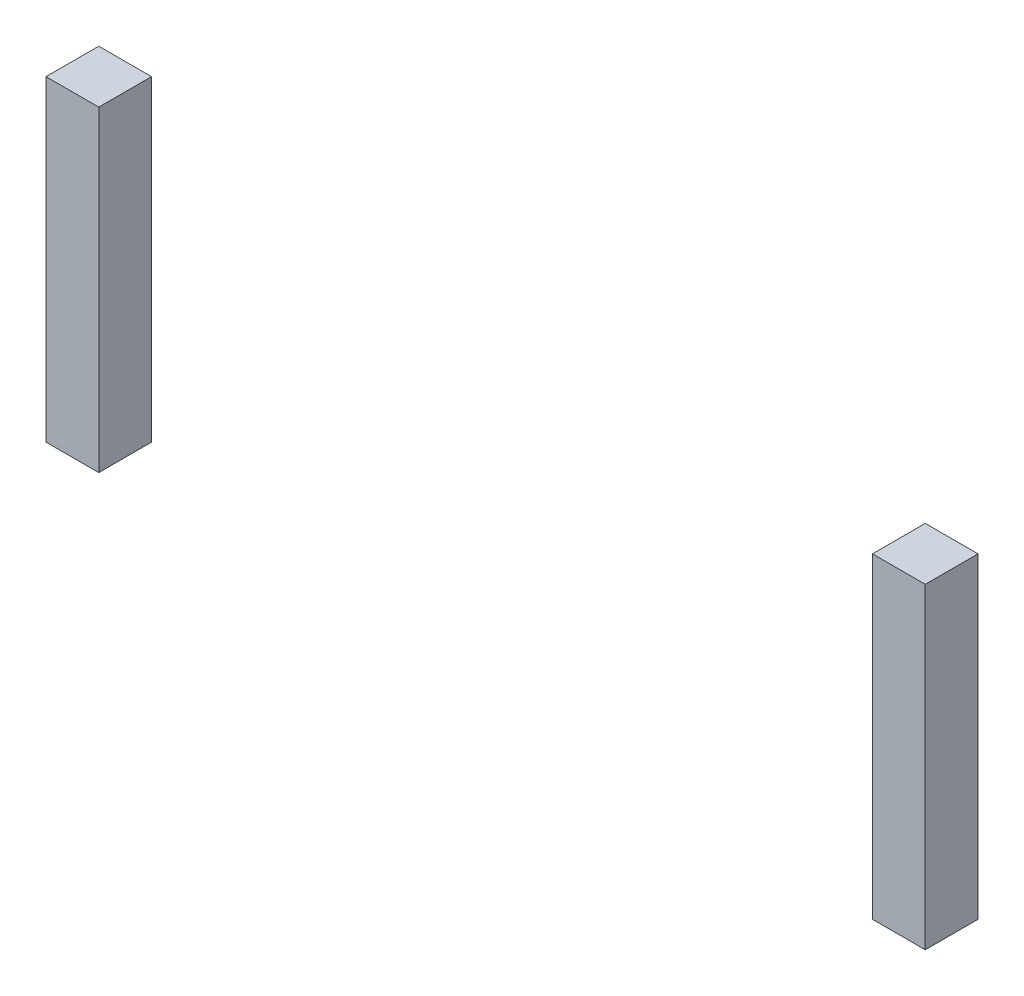
from build123d import *

# Parameters (mm, degrees)
SKETCH_1_W        = 30
SKETCH_1_H        = 180
EXTRUDE_1_DEPTH   = 30
EXTRUDE_1_2_DEPTH = 30


with BuildPart() as part:
    # 草图1 → 凸台-拉伸1 (new body)
    with BuildSketch(Plane.XY):
        with Locations((-40.76049373, 60.047133691)):
            Rectangle(SKETCH_1_W, SKETCH_1_H)
    extrude(amount=EXTRUDE_1_DEPTH)


with BuildPart() as body_2:
    # 草图1 → Extrude 1 2 (new body)
    with BuildSketch(Plane.XY):
        with Locations((429.23950627, 60.047133691)):
            Rectangle(SKETCH_1_W, SKETCH_1_H)
    extrude(amount=EXTRUDE_1_2_DEPTH)


solid = Compound([part.part, body_2.part])
